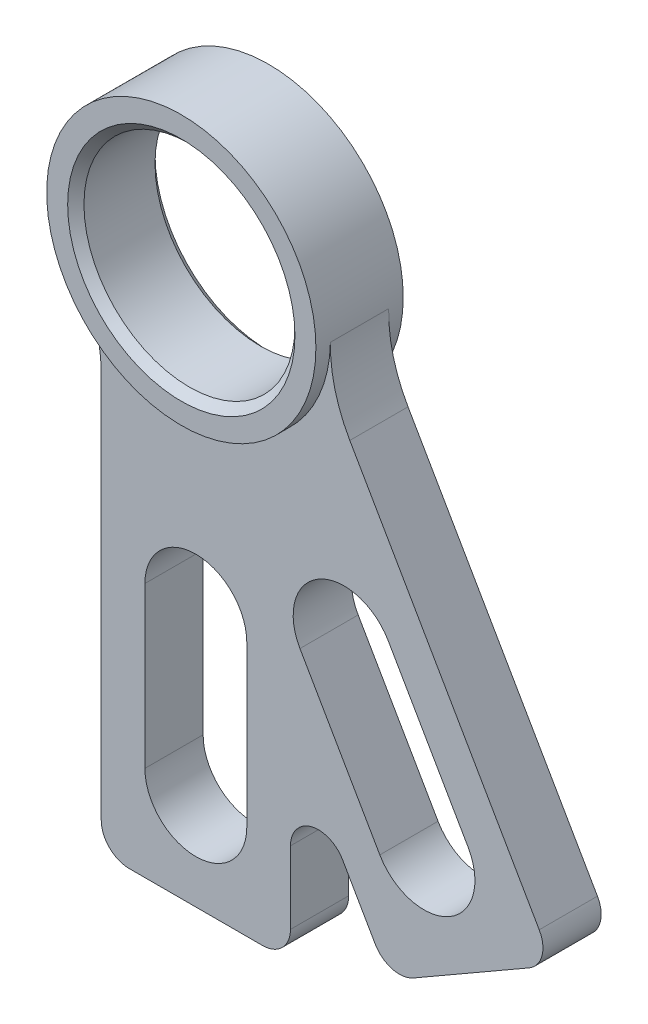
from build123d import *

# Parameters (mm, degrees)
SKETCH1_R           = 11.5062
BOSS_EXTRUDE2_DEPTH = 4.7625
BOSS_EXTRUDE3_DEPTH = 3.175
FILLET1_R           = 3.048
CHAMFER1_SIZE       = 0.889


with BuildPart() as part:
    # Sketch1 → Boss-Extrude2 (new, symmetric)
    with BuildSketch(Plane.XY):
        with BuildLine():
            ThreePointArc((14.678641207, -0.274090755), (-3.790252382, 14.183498169), (-12.585193267, -7.559797873))
            ThreePointArc((-12.585193267, -7.559797873), (3.790252382, -14.183498169), (14.678641207, -0.274090755))
        make_face()
        Circle(SKETCH1_R, mode=Mode.SUBTRACT)
    extrude(amount=BOSS_EXTRUDE2_DEPTH, both=True)

    # Sketch1<4> → Boss-Extrude3 (add, symmetric)
    with BuildSketch(Plane.XY):
        with BuildLine():
            ThreePointArc((-12.585193267, -7.559797873), (-10.89585042, -11.492870345), (-10.31875, -15.734319794))
            Line((-10.31875, -15.734319794), (-10.31875, -60.96))
            Line((-10.31875, -60.96), (10.31875, -60.96))
            Line((10.31875, -60.96), (10.31875, -38.613780025))
            Line((10.31875, -38.613780025), (21.085005048, -57.319442333))
            Line((21.085005048, -57.319442333), (38.971443982, -47.024700544))
            Line((38.971443982, -47.024700544), (16.792075167, -8.489501312))
            ThreePointArc((16.792075167, -8.489501312), (15.176455277, -4.52557514), (14.678641207, -0.274090755))
            ThreePointArc((14.678641207, -0.274090755), (3.790252382, -14.183498169), (-12.585193267, -7.559797873))
        make_face()
        with BuildLine():
            ThreePointArc((5.55625, -50.64125), (0, -56.1975), (-5.55625, -50.64125))
            Line((-5.55625, -50.64125), (-5.55625, -33.17875))
            ThreePointArc((-5.55625, -33.17875), (0, -27.6225), (5.55625, -33.17875))
            Line((5.55625, -33.17875), (5.55625, -50.64125))
        make_face(mode=Mode.SUBTRACT)
        with BuildLine():
            ThreePointArc((29.696433333, -40.45719072), (27.652514871, -48.044431684), (20.065273907, -46.000513222))
            Line((20.065273907, -46.000513222), (11.354338547, -30.865834124))
            ThreePointArc((11.354338547, -30.865834124), (13.398257009, -23.27859316), (20.985497973, -25.322511622))
            Line((20.985497973, -25.322511622), (29.696433333, -40.45719072))
        make_face(mode=Mode.SUBTRACT)
    extrude(amount=BOSS_EXTRUDE3_DEPTH, both=True)

    # Fillet1
    fillet1_edges = [part.edges().sort_by_distance(p)[0] for p in [
        (-10.31875, -60.96, 0),
        (38.971443982, -47.024700544, 0),
        (10.31875, -38.613780025, 0),
        (10.31875, -60.96, 0),
        (21.085005048, -57.319442333, 0),
    ]]
    fillet(fillet1_edges, radius=FILLET1_R)

    # Chamfer1
    chamfer1_edges = [part.edges().sort_by_distance(p)[0] for p in [
        (-11.5062, 0, -4.7625),
        (-11.5062, 0, 4.7625),
    ]]
    chamfer(chamfer1_edges, length=CHAMFER1_SIZE)


solid = part.part
